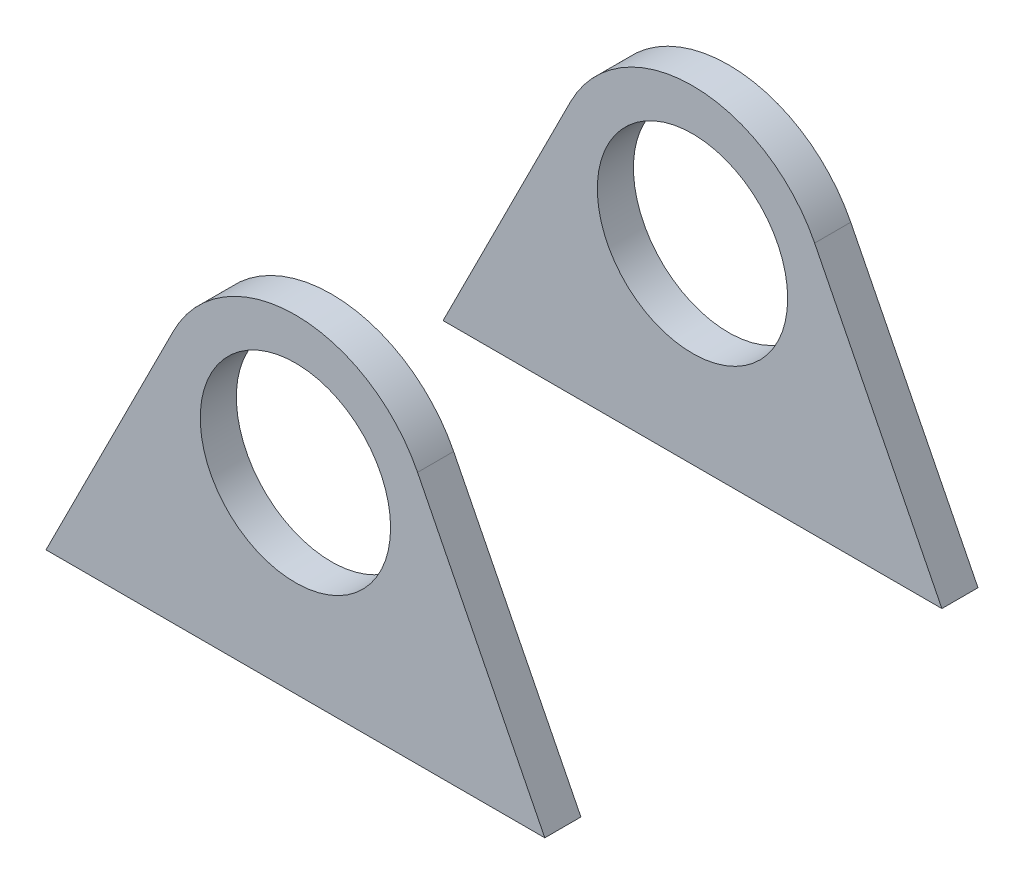
from build123d import *

# Parameters (mm, degrees)
SKETCH1_R           = 8.7
BOSS_EXTRUDE1_DEPTH = 3.3


with BuildPart() as part:
    # Sketch1 → Boss-Extrude1 (new body)
    with BuildSketch(Plane.XY):
        with BuildLine():
            Line((-22.8, -17.5), (22.8, -17.5))
            Line((22.8, -17.5), (11.165886567, 5.618983642))
            ThreePointArc((11.165886567, 5.618983642), (0, 12.5), (-11.165886567, 5.618983642))
            Line((-11.165886567, 5.618983642), (-22.8, -17.5))
        make_face()
        Circle(SKETCH1_R, mode=Mode.SUBTRACT)
    extrude(amount=BOSS_EXTRUDE1_DEPTH)


with BuildPart() as body_2:
    # Mirror6: mirrored copy
    add(part.part.mirror(Plane.XY.offset(19.8)))


solid = Compound([part.part, body_2.part])
